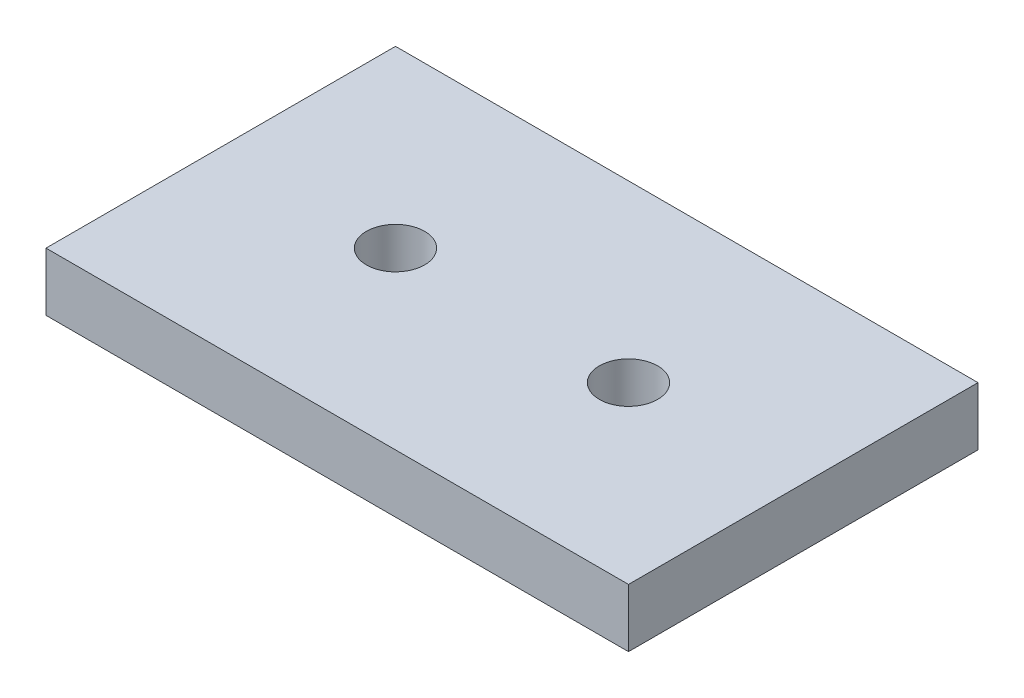
from build123d import *

# Parameters (mm, degrees)
SKETCH_1_W          = 100
SKETCH_1_H          = 60
EXTRUDE_1_DEPTH     = 10
SKETCH_2_R          = 5
CUT_EXTRUDE_1_DEPTH = 20
SKETCH_3_R          = 5
CUT_EXTRUDE_2_DEPTH = 20
CHAMFER_1_SIZE      = 1


with BuildPart() as part:
    # 草图1 → 凸台-拉伸1 (new body)
    with BuildSketch(Plane(origin=(0, 0, 0), x_dir=(1, 0, 0), z_dir=(0, 1, 0))):
        Rectangle(SKETCH_1_W, SKETCH_1_H)
    extrude(amount=EXTRUDE_1_DEPTH)

    # 草图2 → 切除-拉伸1 (cut)
    with BuildSketch(Plane(origin=(0, 0, 0), x_dir=(1, 0, 0), z_dir=(0, 1, 0))):
        with Locations(Location((-20, 0, 0), (0, 0, 90))):
            Circle(SKETCH_2_R)
    extrude(amount=CUT_EXTRUDE_1_DEPTH, mode=Mode.SUBTRACT)

    # 草图3 → 切除-拉伸2 (cut)
    with BuildSketch(Plane(origin=(0, 0, 0), x_dir=(1, 0, 0), z_dir=(0, 1, 0))):
        with Locations(Location((20, 0, 0), (0, 0, 90))):
            Circle(SKETCH_3_R)
    extrude(amount=CUT_EXTRUDE_2_DEPTH, mode=Mode.SUBTRACT)

    # 倒角1
    chamfer_1_edges = [part.edges().sort_by_distance(p)[0] for p in [
        (-20, 0, 5),
        (20, 0, 5),
    ]]
    chamfer(chamfer_1_edges, length=CHAMFER_1_SIZE)


solid = part.part
